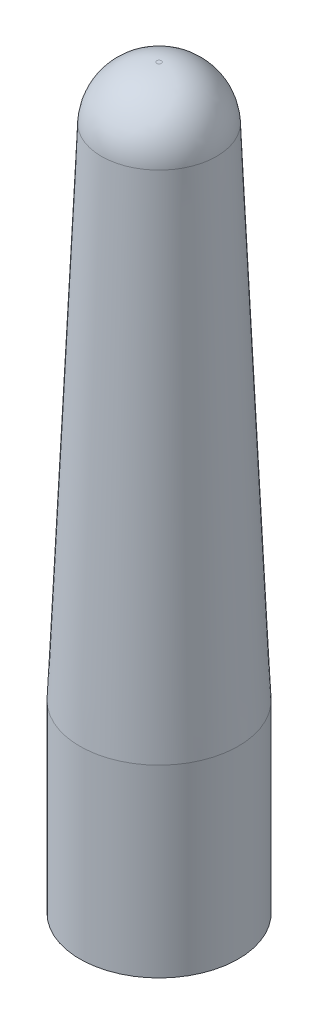
from build123d import *

# Parameters (mm, degrees)
SKETCH2_R           = 5.461
BOSS_EXTRUDE1_DEPTH = 12.7
FILLET1_R           = 3.81


with BuildPart() as part:
    # Sketch1 → Revolve1 (revolve)
    with BuildSketch(Plane.XY, mode=Mode.PRIVATE) as revolve1_sk:
        Polygon((0, 0), (0, 38.1), (3.81, 38.1), (5.461, 0), align=None)
    revolve(revolve1_sk.sketch.rotate(Axis((0, 0, 0), (0, 1, 0)), 90), axis=Axis((0, 0, 0), (0, 1, 0)))

    # Sketch2 → Boss-Extrude1 (add)
    with BuildSketch(Plane(origin=(0, 0, 0), x_dir=(-1, 0, 0), z_dir=(0, -1, 0))):
        with Locations(Location((0, 0, 0), (0, 0, 90))):
            Circle(SKETCH2_R)
    extrude(amount=BOSS_EXTRUDE1_DEPTH)

    # Fillet1
    fillet1_edges = [part.edges().sort_by_distance(p)[0] for p in [
        (0, 38.1, 3.81),
    ]]
    fillet(fillet1_edges, radius=FILLET1_R)


solid = part.part
